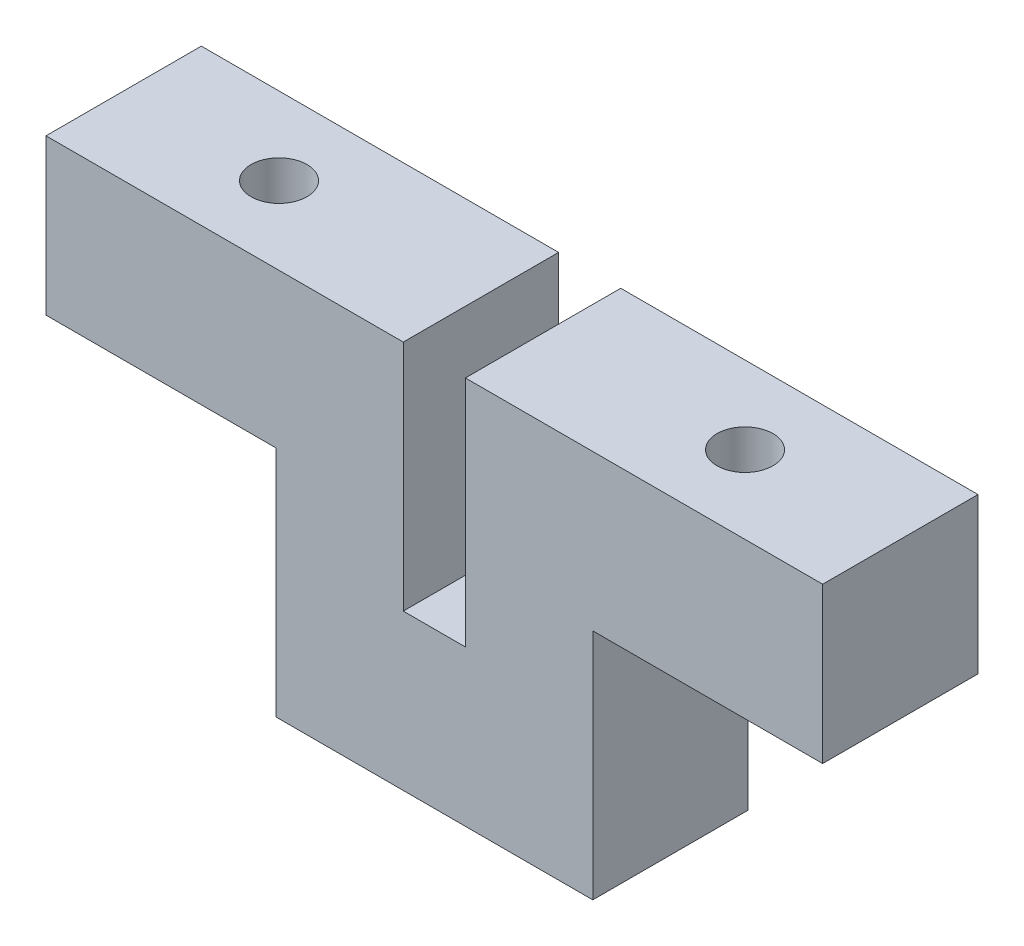
from build123d import *

# Parameters (mm, degrees)
SKETCH1_W           = 50
SKETCH1_H           = 25
BOSS_EXTRUDE1_DEPTH = 10
SKETCH2_R           = 1.8
CUT_EXTRUDE1_DEPTH  = 57.789083458
SKETCH3_W           = 4
SKETCH3_H           = 15
CUT_EXTRUDE2_DEPTH  = 10
SKETCH6_W           = 14.8
SKETCH6_H           = 15
CUT_EXTRUDE3_DEPTH  = 57.789083458


with BuildPart() as part:
    # Sketch1 → Boss-Extrude1 (new body)
    with BuildSketch(Plane.XY):
        with Locations((25, 12.5)):
            Rectangle(SKETCH1_W, SKETCH1_H)
    extrude(amount=BOSS_EXTRUDE1_DEPTH)

    # Sketch2 → Cut-Extrude1 (cut, through all)
    with BuildSketch(Plane(origin=(0, 25, 0), x_dir=(1, 0, 0), z_dir=(0, 1, 0))):
        with Locations(Location((10, -5, 0), (0, 0, 180))):
            Circle(SKETCH2_R)
        with Locations(Location((40, -5, 0), (0, 0, 180))):
            Circle(SKETCH2_R)
    extrude(amount=-CUT_EXTRUDE1_DEPTH, mode=Mode.SUBTRACT)

    # Sketch3 → Cut-Extrude2 (cut)
    with BuildSketch(Plane.XY.offset(10)):
        with Locations((25, 17.5)):
            Rectangle(SKETCH3_W, SKETCH3_H)
    extrude(amount=-CUT_EXTRUDE2_DEPTH, mode=Mode.SUBTRACT)

    # Sketch6 → Cut-Extrude3 (cut, through all)
    with BuildSketch(Plane.XY.offset(10)):
        with Locations((7.4, 7.5)):
            Rectangle(SKETCH6_W, SKETCH6_H)
        with Locations((42.6, 7.5)):
            Rectangle(SKETCH6_W, SKETCH6_H)
    extrude(amount=-CUT_EXTRUDE3_DEPTH, mode=Mode.SUBTRACT)


solid = part.part
